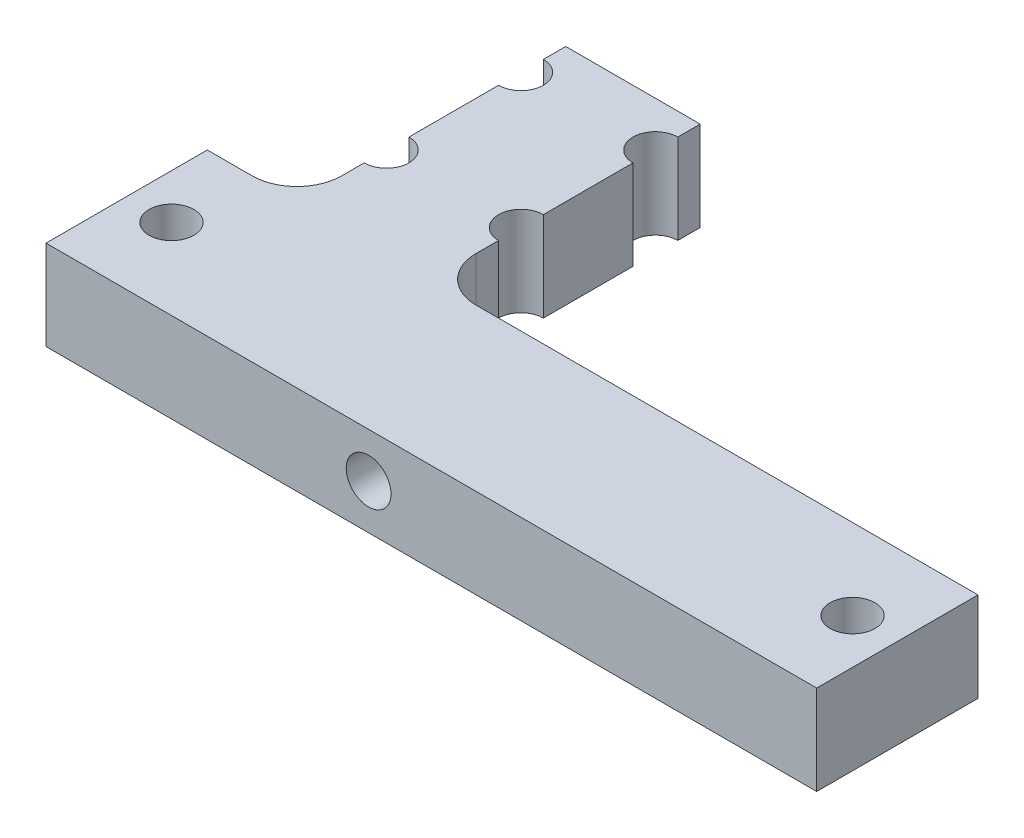
from build123d import *

# Parameters (mm, degrees)
SKETCH1_R           = 1.5875
BOSS_EXTRUDE1_DEPTH = 6.35
FILLET1_R           = 3.175
SKETCH2_R           = 1.5875
TIES_HOLE_DEPTH     = 34.893775609


with BuildPart() as part:
    # Sketch1 → Boss-Extrude1 (new body)
    with BuildSketch(Plane(origin=(0, 0, 0), x_dir=(1, 0, 0), z_dir=(0, 1, 0))):
        with BuildLine():
            Line((-27.305, 5.715), (-20.955, 5.715))
            Line((-20.955, 5.715), (-20.955, 10.4775))
            ThreePointArc((-20.955, 10.4775), (-19.3675, 12.065), (-20.955, 13.6525))
            Line((-20.955, 13.6525), (-20.955, 20.0025))
            ThreePointArc((-20.955, 20.0025), (-19.3675, 21.59), (-20.955, 23.1775))
            Line((-20.955, 23.1775), (-20.955, 24.765))
            Line((-20.955, 24.765), (-11.43, 24.765))
            Line((-11.43, 24.765), (-11.43, 23.1775))
            ThreePointArc((-11.43, 23.1775), (-13.0175, 21.59), (-11.43, 20.0025))
            Line((-11.43, 20.0025), (-11.43, 13.6525))
            ThreePointArc((-11.43, 13.6525), (-13.0175, 12.065), (-11.43, 10.4775))
            Line((-11.43, 10.4775), (-11.43, 5.715))
            Line((-11.43, 5.715), (27.305, 5.715))
            Line((27.305, 5.715), (27.305, -5.715))
            Line((27.305, -5.715), (-27.305, -5.715))
            Line((-27.305, -5.715), (-27.305, 5.715))
        make_face()
        with Locations(Location((-24.13, 0, 0), (0, 0, 270))):
            Circle(SKETCH1_R, mode=Mode.SUBTRACT)
        with Locations(Location((24.13, 0, 0), (0, 0, 270))):
            Circle(SKETCH1_R, mode=Mode.SUBTRACT)
    extrude(amount=BOSS_EXTRUDE1_DEPTH)

    # Fillet1
    fillet1_edges = [part.edges().sort_by_distance(p)[0] for p in [
        (-20.955, 3.175, -5.715),
        (-11.43, 3.175, -5.715),
    ]]
    fillet(fillet1_edges, radius=FILLET1_R)

    # Sketch2 → ties hole (cut, through all)
    with BuildSketch(Plane(origin=(0, 0, -5.715), x_dir=(-1, 0, 0), z_dir=(0, 0, -1))):
        with Locations((4.445, 3.175)):
            Circle(SKETCH2_R)
    extrude(amount=-TIES_HOLE_DEPTH, mode=Mode.SUBTRACT)


solid = part.part
